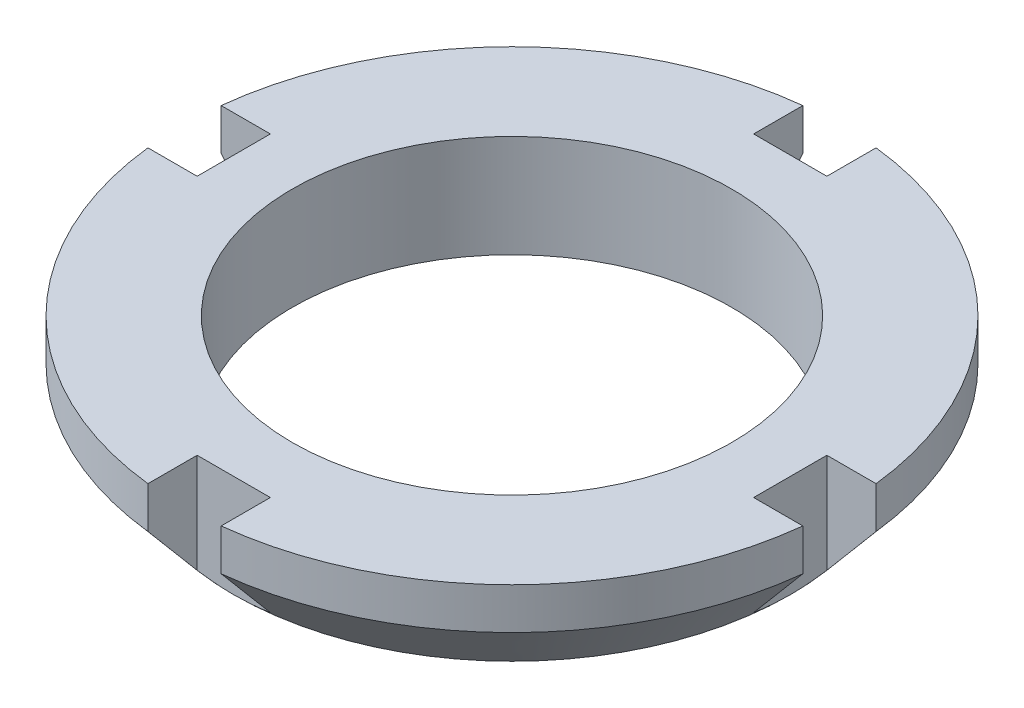
from build123d import *

# Parameters (mm, degrees)
NOTCH_DEPTH       = 33.580669115
CIRPATTERN1_COUNT = 4


with BuildPart() as part:
    # Profile → Nut (revolve)
    with BuildSketch(Plane.XY):
        Polygon((15, 7), (15, 0), (19, 0), (22.5, 4.171137574), (22.5, 7), align=None)
    revolve(axis=Axis((0, 25.4, 0), (0, -1, 0)))

    # Cut → Notch (cut, through all)
    with BuildSketch(Plane(origin=(0, 7, 0), x_dir=(-1, 0, 0), z_dir=(0, 1, 0))):
        with BuildLine():
            Line((2.5, -19), (-2.5, -19))
            Line((-2.5, -19), (-2.5, -22.360679775))
            ThreePointArc((-2.5, -22.360679775), (0, -22.5), (2.5, -22.360679775))
            Line((2.5, -22.360679775), (2.5, -19))
        make_face()
    notch = extrude(amount=-NOTCH_DEPTH, mode=Mode.SUBTRACT)

    # CirPattern1: Notch ×4 about axis
    cirpattern1_axis = Axis((0, -9.659760956, 0), (0, 1, 0))
    for i in range(1, CIRPATTERN1_COUNT):
        add(notch.rotate(cirpattern1_axis, i * 360 / CIRPATTERN1_COUNT), mode=Mode.SUBTRACT)


solid = part.part
